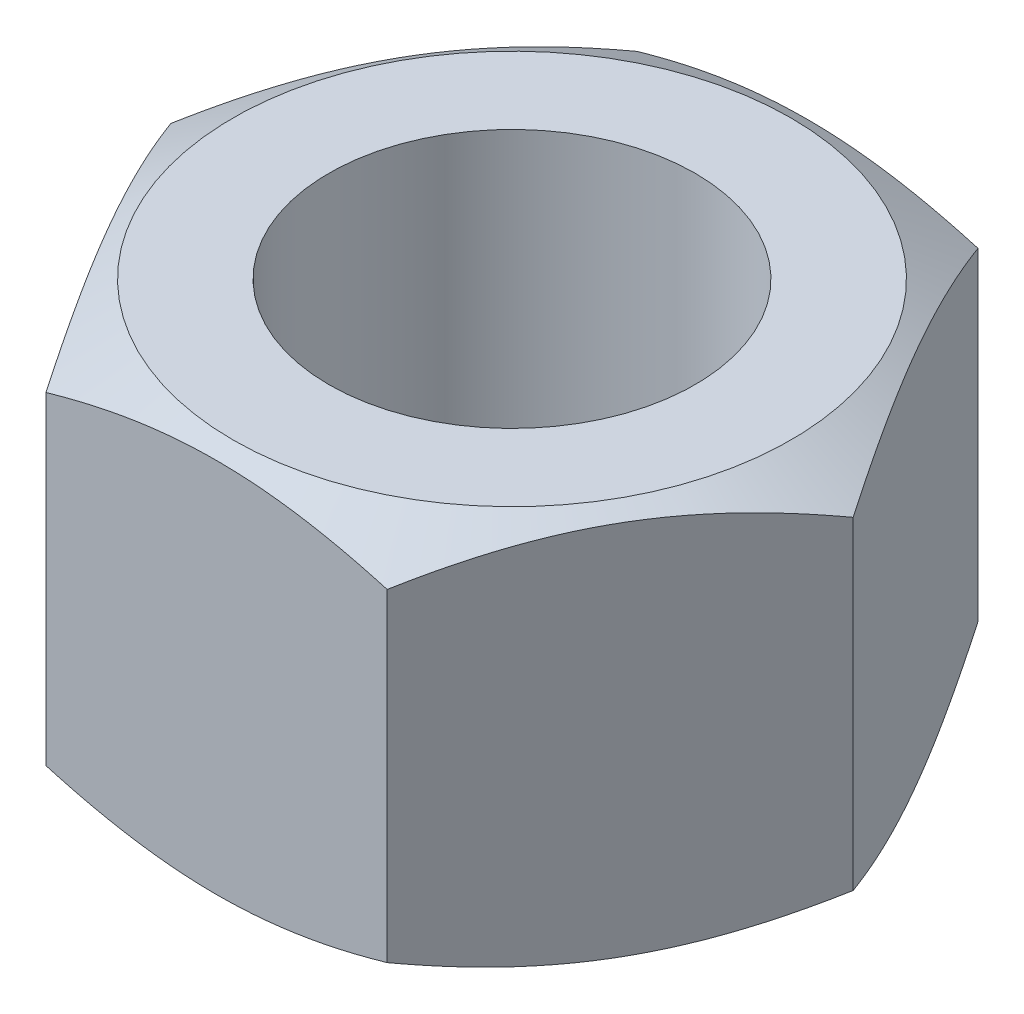
from build123d import *

# Parameters (mm, degrees)
EXTRUDE_1_DEPTH     = 11
HOLE_WIZARD_M12_1_D = 10.2


with BuildPart() as part:
    # 草图1 → 凸台-拉伸1 (new body)
    with BuildSketch(Plane(origin=(0, 0, 0), x_dir=(1, 0, 0), z_dir=(0, 1, 0))):
        Polygon((9.5, 0), (4.75, 8.227241336), (-4.75, 8.227241336), (-9.5, 0), (-4.75, -8.227241336), (4.75, -8.227241336), align=None)
    extrude(amount=EXTRUDE_1_DEPTH)

    # M12 螺纹孔1 (through all)
    with Locations(Plane(origin=(0, 11, 0), x_dir=(1, 0, 0), z_dir=(0, 1, 0))):
        with Locations((0, 0)):
            Hole(HOLE_WIZARD_M12_1_D / 2)

    # 草图4 → 切除-旋转1 (revolve, cut)
    with BuildSketch(Plane.XY, mode=Mode.PRIVATE) as cut_revolve_1_sk:
        Polygon((-9.5, 10), (-7.767949192, 11), (-9.5, 11), align=None)
    cut_revolve_1 = revolve(cut_revolve_1_sk.sketch.rotate(Axis((0, 0, 0), (0, 1, 0)), 90), axis=Axis((0, 0, 0), (0, 1, 0)), mode=Mode.SUBTRACT)

    # 镜向1: 切除-旋转1 across plane
    add(cut_revolve_1.mirror(Plane.ZX.offset(5.5)), mode=Mode.SUBTRACT)


solid = part.part
